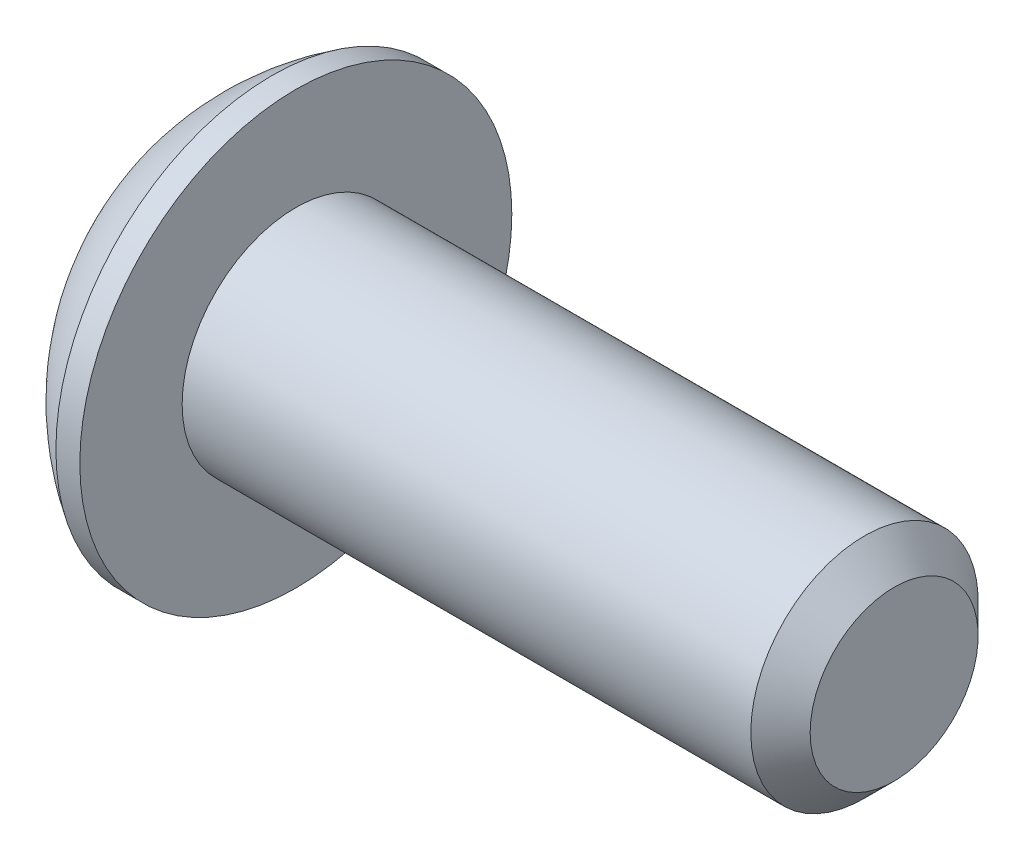
from build123d import *

# Parameters (mm, degrees)
HEX_2_DEPTH = 1.778


with BuildPart() as part:
    # BodySke → BaseBody (revolve)
    with BuildSketch(Plane.XY, mode=Mode.PRIVATE) as basebody_sk:
        with BuildLine():
            Line((15.2654, 0), (15.2654, 1.78308))
            Line((15.2654, 1.78308), (14.63548, 2.413))
            Line((14.63548, 2.413), (2.5654, 2.413))
            Line((2.5654, 2.413), (2.5654, 4.5847))
            Line((2.5654, 4.5847), (2.0574, 4.5847))
            ThreePointArc((2.0574, 4.5847), (0.860923645, 3.589105441), (0, 2.29235))
            Line((0, 2.29235), (0, 0))
            Line((0, 0), (15.2654, 0))
        make_face()
    revolve(basebody_sk.sketch.rotate(Axis((0, 0, 0), (1, 0, 0)), 90), axis=Axis((0, 0, 0), (1, 0, 0)))

    # Sketch2 → PreBroach (revolve, cut)
    with BuildSketch(Plane.XY, mode=Mode.PRIVATE) as prebroach_sk:
        Polygon((0, 1.5875), (1.778, 1.5875), (2.694543552, 0), (0, 0), align=None)
    revolve(prebroach_sk.sketch.rotate(Axis((0, 0, 0), (1, 0, 0)), 90), axis=Axis((0, 0, 0), (1, 0, 0)), mode=Mode.SUBTRACT)

    # Sketch3 → Hex 2 (cut)
    with BuildSketch(Plane(origin=(0, 0, 0), x_dir=(0, 0, -1), z_dir=(1, 0, 0))):
        Polygon((-1.5875, -0.916543552), (-1.5875, 0.916543552), (0, 1.833087105), (1.5875, 0.916543552), (1.5875, -0.916543552), (0, -1.833087105), align=None)
    extrude(amount=HEX_2_DEPTH, mode=Mode.SUBTRACT)


solid = part.part
